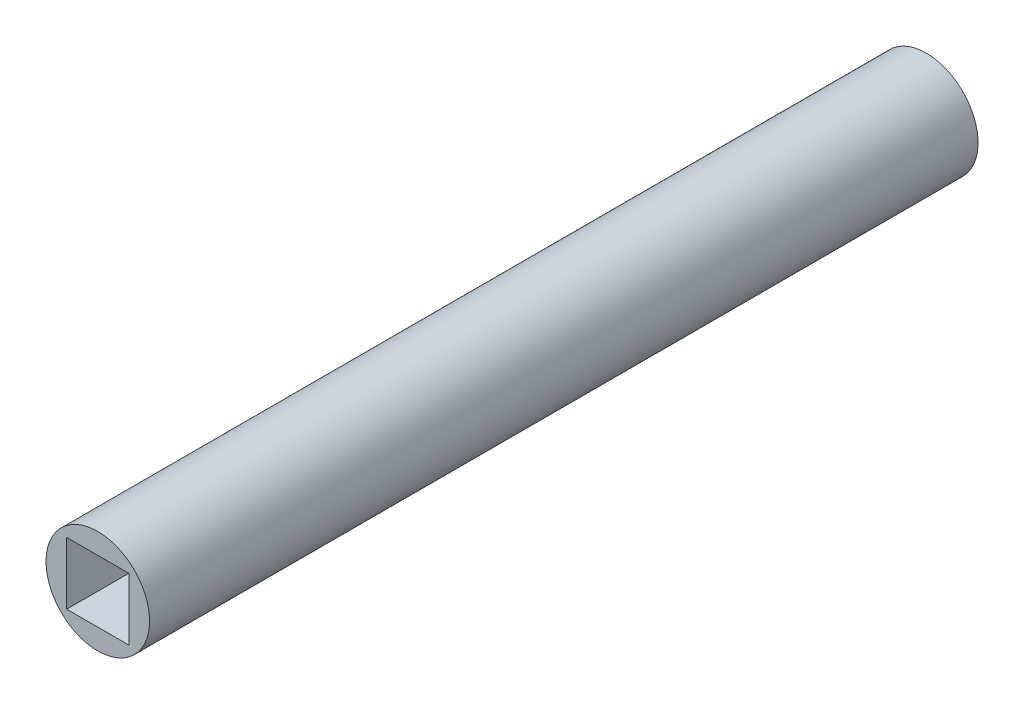
from build123d import *

# Parameters (mm, degrees)
SKETCH1_W          = 15.875
SKETCH1_H          = 254
SKETCH2_W          = 19.05
SKETCH2_H          = 19.05
CUT_EXTRUDE1_DEPTH = 255.990257167


with BuildPart() as part:
    # Sketch1 → Revolve1 (revolve)
    with BuildSketch(Plane(origin=(0, 0, 0), x_dir=(1, 0, 0), z_dir=(0, 1, 0))):
        with Locations((-7.9375, -127)):
            Rectangle(SKETCH1_W, SKETCH1_H)
    revolve(axis=Axis((0, 0, 0), (0, 0, 1)))

    # Sketch2 → Cut-Extrude1 (cut, through all)
    with BuildSketch(Plane.XY.offset(254)):
        Rectangle(SKETCH2_W, SKETCH2_H)
    extrude(amount=-CUT_EXTRUDE1_DEPTH, mode=Mode.SUBTRACT)


solid = part.part
